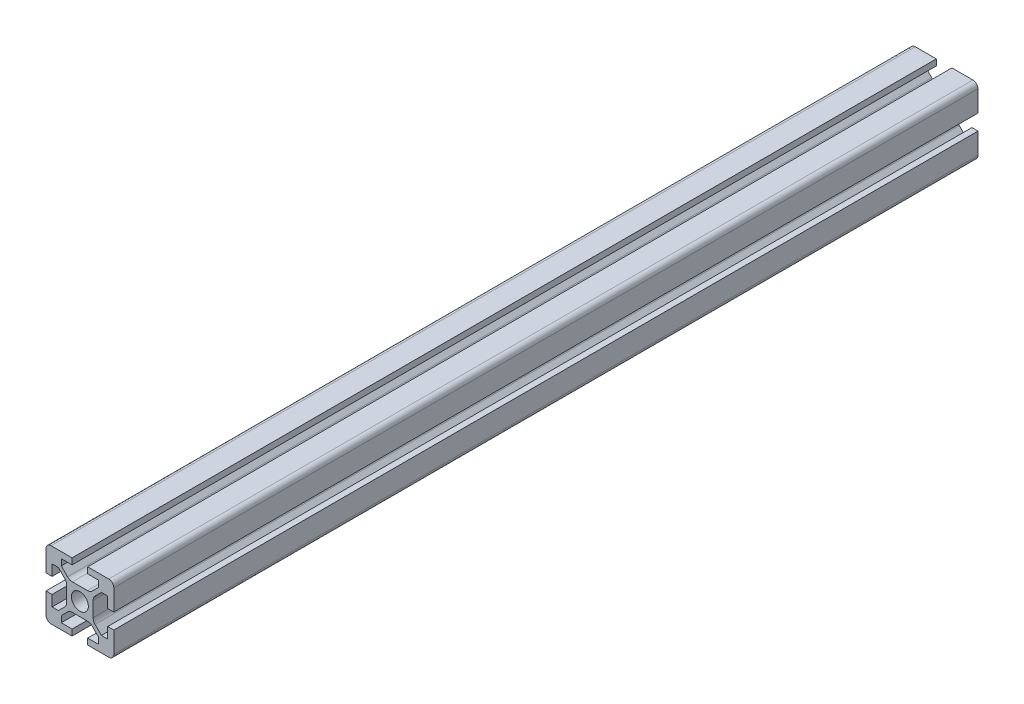
from build123d import *

# Parameters (mm, degrees)
SALIENTE_EXTRUIR1_DEPTH = 255


with BuildPart() as part:
    # Croquis1 → Saliente-Extruir1 (new body)
    with BuildSketch(Plane.XY):
        with BuildLine():
            Line((-10, 8.5), (-10, 2.3))
            Line((-10, 2.3), (-8.2, 2.3))
            Line((-8.2, 2.3), (-8.2, 5.5))
            Line((-8.2, 5.5), (-6.348528137, 5.5))
            Line((-6.348528137, 5.5), (-4.485786438, 3.6372583))
            ThreePointArc((-4.485786438, 3.6372583), (-4.052240935, 2.988411603), (-3.9, 2.223044738))
            Line((-3.9, 2.223044738), (-3.9, 0))
            Line((-3.9, 0), (-3.9, -2.223044738))
            ThreePointArc((-3.9, -2.223044738), (-4.052240935, -2.988411603), (-4.485786438, -3.6372583))
            Line((-4.485786438, -3.6372583), (-6.348528137, -5.5))
            Line((-6.348528137, -5.5), (-8.2, -5.5))
            Line((-8.2, -5.5), (-8.2, -2.3))
            Line((-8.2, -2.3), (-10, -2.3))
            Line((-10, -2.3), (-10, -8.5))
            ThreePointArc((-10, -8.5), (-9.560660172, -9.560660172), (-8.5, -10))
            Line((-8.5, -10), (-2.3, -10))
            Line((-2.3, -10), (-2.3, -8.2))
            Line((-2.3, -8.2), (-5.5, -8.2))
            Line((-5.5, -8.2), (-5.5, -6.348528137))
            Line((-5.5, -6.348528137), (-3.6372583, -4.485786438))
            ThreePointArc((-3.6372583, -4.485786438), (-2.988411603, -4.052240935), (-2.223044738, -3.9))
            Line((-2.223044738, -3.9), (0, -3.9))
            Line((0, -3.9), (2.223044738, -3.9))
            ThreePointArc((2.223044738, -3.9), (2.988411603, -4.052240935), (3.6372583, -4.485786438))
            Line((3.6372583, -4.485786438), (5.5, -6.348528137))
            Line((5.5, -6.348528137), (5.5, -8.2))
            Line((5.5, -8.2), (2.3, -8.2))
            Line((2.3, -8.2), (2.3, -10))
            Line((2.3, -10), (8.5, -10))
            ThreePointArc((8.5, -10), (9.560660172, -9.560660172), (10, -8.5))
            Line((10, -8.5), (10, -2.3))
            Line((10, -2.3), (8.2, -2.3))
            Line((8.2, -2.3), (8.2, -5.5))
            Line((8.2, -5.5), (6.348528137, -5.5))
            Line((6.348528137, -5.5), (4.485786438, -3.6372583))
            ThreePointArc((4.485786438, -3.6372583), (4.052240935, -2.988411603), (3.9, -2.223044738))
            Line((3.9, -2.223044738), (3.9, 0))
            Line((3.9, 0), (3.9, 2.223044738))
            ThreePointArc((3.9, 2.223044738), (4.052240935, 2.988411603), (4.485786438, 3.6372583))
            Line((4.485786438, 3.6372583), (6.348528137, 5.5))
            Line((6.348528137, 5.5), (8.2, 5.5))
            Line((8.2, 5.5), (8.2, 2.3))
            Line((8.2, 2.3), (10, 2.3))
            Line((10, 2.3), (10, 8.5))
            ThreePointArc((10, 8.5), (9.560660172, 9.560660172), (8.5, 10))
            Line((8.5, 10), (2.3, 10))
            Line((2.3, 10), (2.3, 8.2))
            Line((2.3, 8.2), (5.5, 8.2))
            Line((5.5, 8.2), (5.5, 6.348528137))
            Line((5.5, 6.348528137), (3.6372583, 4.485786438))
            ThreePointArc((3.6372583, 4.485786438), (2.988411603, 4.052240935), (2.223044738, 3.9))
            Line((2.223044738, 3.9), (0, 3.9))
            Line((0, 3.9), (-2.223044738, 3.9))
            ThreePointArc((-2.223044738, 3.9), (-2.988411603, 4.052240935), (-3.6372583, 4.485786438))
            Line((-3.6372583, 4.485786438), (-5.5, 6.348528137))
            Line((-5.5, 6.348528137), (-5.5, 8.2))
            Line((-5.5, 8.2), (-2.3, 8.2))
            Line((-2.3, 8.2), (-2.3, 10))
            Line((-2.3, 10), (-8.5, 10))
            ThreePointArc((-8.5, 10), (-9.560660172, 9.560660172), (-10, 8.5))
        make_face()
        with BuildLine():
            ThreePointArc((0, 2.5), (-1.767766953, 1.767766953), (-2.5, 0))
            ThreePointArc((-2.5, 0), (-1.767766953, -1.767766953), (0, -2.5))
            ThreePointArc((0, -2.5), (1.767766953, -1.767766953), (2.5, 0))
            ThreePointArc((2.5, 0), (1.767766953, 1.767766953), (0, 2.5))
        make_face(mode=Mode.SUBTRACT)
    extrude(amount=SALIENTE_EXTRUIR1_DEPTH)


solid = part.part
